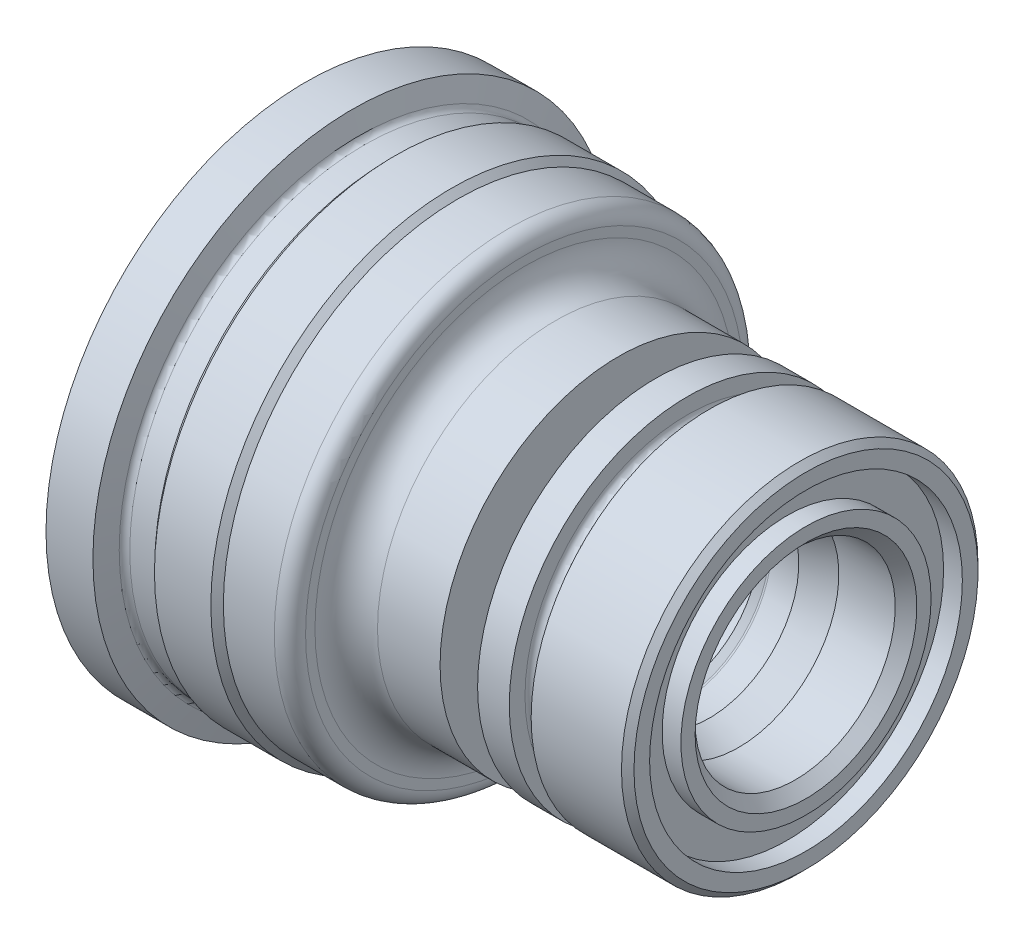
from build123d import *

# Parameters (mm, degrees)
CHAMFER1_SIZE      = 1.27
SKETCH2_R          = 31.75
SKETCH2_R_2        = 25.4
CUT_EXTRUDE1_DEPTH = 3.81
SKETCH4_R          = 36.83
SKETCH4_R_2        = 27.305
CUT_EXTRUDE2_DEPTH = 6.35
CHAMFER2_SIZE      = 1.27


with BuildPart() as part:
    # Sketch1 → Base-Revolve (revolve)
    with BuildSketch(Plane.XY, mode=Mode.PRIVATE) as base_revolve_sk:
        with BuildLine():
            Line((78.662391488, 22.514842933), (78.662391488, 36.195))
            Line((78.662391488, 36.195), (73.129905821, 36.195))
            Line((73.129905821, 36.195), (59.055, 36.195))
            Line((59.055, 36.195), (59.055, 33.000817911))
            ThreePointArc((59.055, 33.000817911), (58.683025612, 32.102792299), (57.785, 31.730817911))
            Line((57.785, 31.730817911), (55.88, 31.730817911))
            ThreePointArc((55.88, 31.730817911), (54.981974388, 32.102792299), (54.61, 33.000817911))
            Line((54.61, 33.000817911), (54.61, 36.195))
            Line((54.61, 36.195), (48.182391488, 36.195))
            Line((48.182391488, 36.195), (48.182391488, 22.606))
            ThreePointArc((48.182391488, 22.606), (47.8104171, 21.707974388), (46.912391488, 21.336))
            Line((46.912391488, 21.336), (41.832391488, 21.336))
            ThreePointArc((41.832391488, 21.336), (40.934365876, 21.707974388), (40.562391488, 22.606))
            Line((40.562391488, 22.606), (40.562391488, 36.195))
            Line((40.562391488, 36.195), (27.862391488, 36.195))
            ThreePointArc((27.862391488, 36.195), (23.372263427, 38.054871939), (21.512391488, 42.545))
            Line((21.512391488, 42.545), (21.512391488, 44.45))
            ThreePointArc((21.512391488, 44.45), (20.582455518, 46.69506403), (18.337391488, 47.625))
            Line((18.337391488, 47.625), (7.991092352, 47.625))
            Line((7.991092352, 47.625), (6.721092352, 48.895))
            Line((6.721092352, 48.895), (-4.730293399, 48.895))
            Line((-4.730293399, 48.895), (-5.928712777, 47.625))
            Line((-5.928712777, 47.625), (-11.008712777, 47.625))
            ThreePointArc((-11.008712777, 47.625), (-11.774120598, 47.881564819), (-12.230273744, 48.54759706))
            Line((-12.230273744, 48.54759706), (-13.412608512, 52.705))
            Line((-13.412608512, 52.705), (-22.937608512, 52.705))
            Line((-22.937608512, 52.705), (-22.937608512, 17.145))
            Line((-22.937608512, 17.145), (28.485495276, 17.145))
            Line((28.485495276, 17.145), (28.485495276, 19.05))
            ThreePointArc((28.485495276, 19.05), (28.857469664, 19.948025612), (29.755495276, 20.32))
            Line((29.755495276, 20.32), (36.105495276, 20.32))
            ThreePointArc((36.105495276, 20.32), (37.003520888, 19.948025612), (37.375495276, 19.05))
            Line((37.375495276, 19.05), (37.375495276, 17.145))
            Line((37.375495276, 17.145), (51.99854353, 17.145))
            Line((51.99854353, 17.145), (53.204533333, 18.049492352))
            ThreePointArc((53.204533333, 18.049492352), (53.348689628, 18.125023468), (53.509333333, 18.151092352))
            Line((53.509333333, 18.151092352), (59.055, 18.151092352))
            Line((59.055, 18.151092352), (65.014024787, 20.32))
            Line((65.014024787, 20.32), (76.467548555, 20.32))
            Line((76.467548555, 20.32), (78.662391488, 22.514842933))
        make_face()
    revolve(base_revolve_sk.sketch.rotate(Axis((74.93, 0, 0), (1, 0, 0)), 90), axis=Axis((74.93, 0, 0), (1, 0, 0)))

    # Chamfer1
    chamfer1_edges = [part.edges().sort_by_distance(p)[0] for p in [
        (78.662391488, 0, -36.195),
    ]]
    chamfer(chamfer1_edges, length=CHAMFER1_SIZE)

    # Sketch2 → Cut-Extrude1 (cut)
    with BuildSketch(Plane(origin=(78.662391488, 0, 0), x_dir=(0, 0, -1), z_dir=(1, 0, 0))):
        Circle(SKETCH2_R)
        Circle(SKETCH2_R_2, mode=Mode.SUBTRACT)
    extrude(amount=-CUT_EXTRUDE1_DEPTH, mode=Mode.SUBTRACT)

    # Sketch4 → Cut-Extrude2 (cut)
    with BuildSketch(Plane.ZY.offset(22.937608512)):
        Circle(SKETCH4_R)
        Circle(SKETCH4_R_2, mode=Mode.SUBTRACT)
    extrude(amount=-CUT_EXTRUDE2_DEPTH, mode=Mode.SUBTRACT)

    # Chamfer2
    chamfer2_edges = [part.edges().sort_by_distance(p)[0] for p in [
        (-22.937608512, 0, -27.305),
        (-22.937608512, 0, -36.83),
    ]]
    chamfer(chamfer2_edges, length=CHAMFER2_SIZE)


solid = part.part
